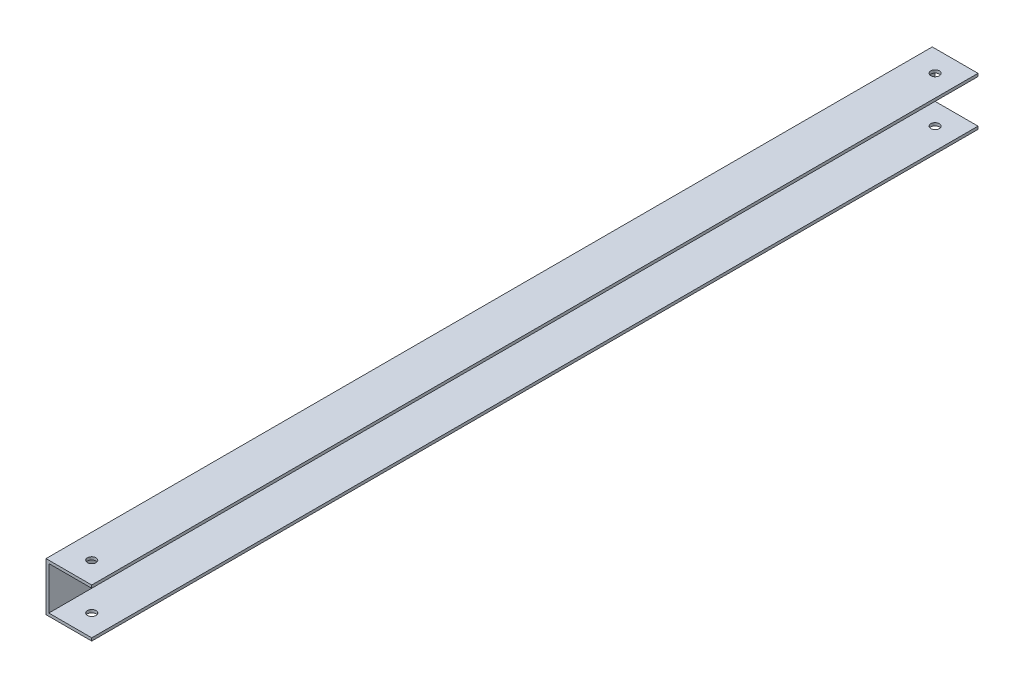
from build123d import *

# Parameters (mm, degrees)
BOSS_EXTRUDE1_DEPTH = 620
SKETCH2_R           = 3
CUT_EXTRUDE1_DEPTH  = 622.164229492


with BuildPart() as part:
    # Sketch1 → Boss-Extrude1 (new body)
    with BuildSketch(Plane.XY):
        Polygon((15, 15), (15, 17), (-17, 17), (-17, -17), (15, -17), (15, -15), (-15, -15), (-15, 15), align=None)
    extrude(amount=BOSS_EXTRUDE1_DEPTH)

    # Sketch2 → Cut-Extrude1 (cut, through all)
    with BuildSketch(Plane(origin=(0, 17, 0), x_dir=(1, 0, 0), z_dir=(0, 1, 0))):
        with Locations(Location((0, -605, 0), (0, 0, 270))):
            Circle(SKETCH2_R)
        with Locations(Location((0, -15, 0), (0, 0, 270))):
            Circle(SKETCH2_R)
    extrude(amount=-CUT_EXTRUDE1_DEPTH, mode=Mode.SUBTRACT)


solid = part.part
